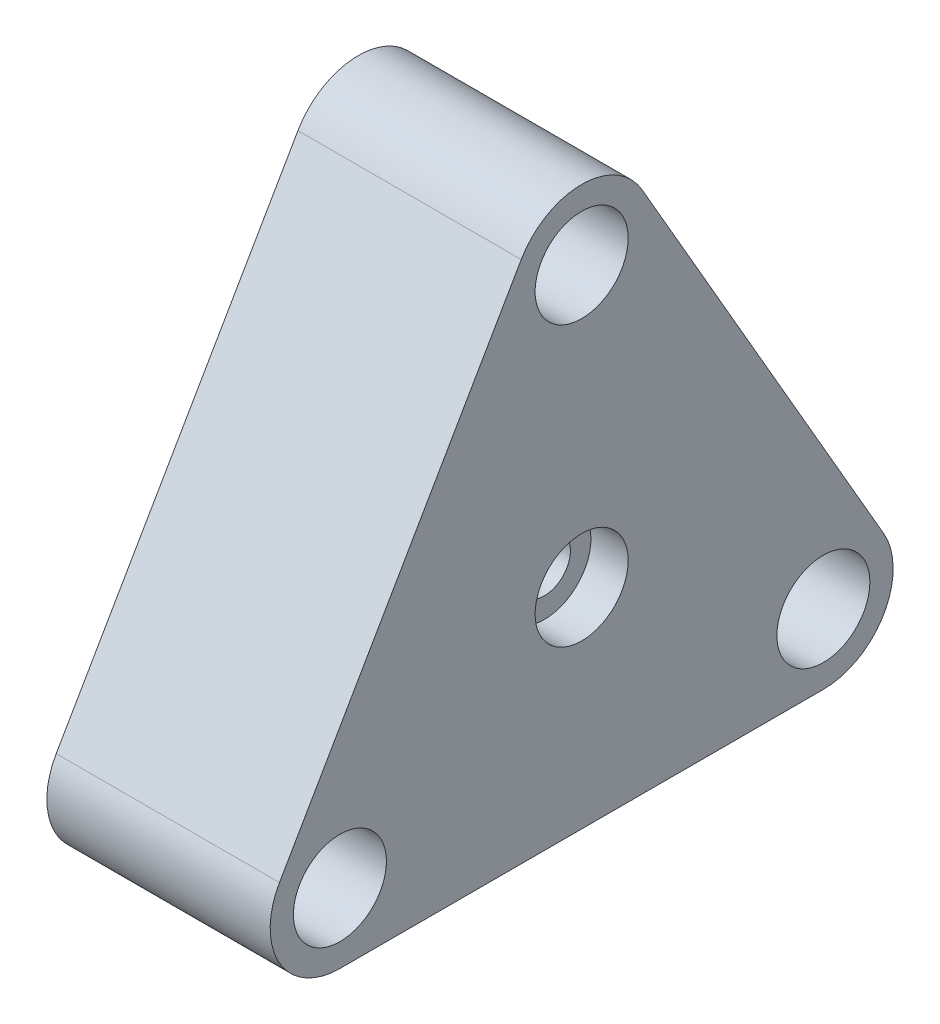
from build123d import *

# Parameters (mm, degrees)
BOSS_EXTRUDE1_DEPTH       = 6
SKETCH4_R                 = 2.5
CUT_EXTRUDE1_DEPTH        = 6
SKETCH5_R                 = 2.5
CUT_EXTRUDE2_DEPTH        = 6
F_3_CLEARANCE_HOLE1_D     = 2.794
F_3_CLEARANCE_HOLE1_DEPTH = 6
F_3_CLEARANCE_HOLE1_TIP   = 0.839402285
F_3_CLEARANCE_HOLE2_D     = 2.794
F_3_CLEARANCE_HOLE2_DEPTH = 6
F_3_CLEARANCE_HOLE2_TIP   = 0.839402285
CUT_EXTRUDE3_START        = -2
SKETCH11_R                = 2.5
CUT_EXTRUDE3_DEPTH        = 2
CUT_EXTRUDE4_START        = -2
SKETCH12_R                = 2.5
CUT_EXTRUDE4_DEPTH        = 2


with BuildPart() as part:
    # Sketch3 → Boss-Extrude1 (new, symmetric)
    with BuildSketch(Plane(origin=(0, 0, 0), x_dir=(0, 0, -1), z_dir=(1, 0, 0))):
        with BuildLine():
            Line((-16.237976321, -5.625), (-3.247595264, 16.875))
            ThreePointArc((-3.247595264, 16.875), (0, 18.75), (3.247595264, 16.875))
            Line((3.247595264, 16.875), (16.237976321, -5.625))
            ThreePointArc((16.237976321, -5.625), (16.237976321, -9.375), (12.990381057, -11.25))
            Line((12.990381057, -11.25), (-12.990381057, -11.25))
            ThreePointArc((-12.990381057, -11.25), (-16.237976321, -9.375), (-16.237976321, -5.625))
        make_face()
    extrude(amount=BOSS_EXTRUDE1_DEPTH, both=True)

    # Sketch4 → Cut-Extrude1 (cut)
    with BuildSketch(Plane(origin=(6, 0, 0), x_dir=(0, 0, -1), z_dir=(1, 0, 0))):
        with Locations((0, 15)):
            Circle(SKETCH4_R)
        with Locations((-12.990381057, -7.5)):
            Circle(SKETCH4_R)
        with Locations((12.990381057, -7.5)):
            Circle(SKETCH4_R)
    extrude(amount=-CUT_EXTRUDE1_DEPTH, mode=Mode.SUBTRACT)

    # Sketch5 → Cut-Extrude2 (cut)
    with BuildSketch(Plane.ZY.offset(6)):
        Circle(SKETCH5_R)
    extrude(amount=-CUT_EXTRUDE2_DEPTH, mode=Mode.SUBTRACT)

    # #3 Clearance Hole1
    with Locations(Plane(origin=(0, 0, 0), x_dir=(0, 0, -1), z_dir=(1, 0, 0))):
        with Locations((12.990381057, -7.5), (0, 15), (-12.990381057, -7.5)):
            Hole(F_3_CLEARANCE_HOLE1_D / 2, depth=F_3_CLEARANCE_HOLE1_DEPTH)
            with Locations((0, 0, -(F_3_CLEARANCE_HOLE1_DEPTH + F_3_CLEARANCE_HOLE1_TIP / 2))):  # 118° drill point
                Cone(0, F_3_CLEARANCE_HOLE1_D / 2, F_3_CLEARANCE_HOLE1_TIP, mode=Mode.SUBTRACT)

    # #3 Clearance Hole2
    with Locations(Plane.ZY):
        with Locations((0, 0)):
            Hole(F_3_CLEARANCE_HOLE2_D / 2, depth=F_3_CLEARANCE_HOLE2_DEPTH)
            with Locations((0, 0, -(F_3_CLEARANCE_HOLE2_DEPTH + F_3_CLEARANCE_HOLE2_TIP / 2))):  # 118° drill point
                Cone(0, F_3_CLEARANCE_HOLE2_D / 2, F_3_CLEARANCE_HOLE2_TIP, mode=Mode.SUBTRACT)

    # Sketch11 → Cut-Extrude3 (cut)
    with BuildSketch(Plane.ZY.offset(6).offset(CUT_EXTRUDE3_START)):
        with Locations(Location((0, 15, 0), (0, 0, 180))):
            Circle(SKETCH11_R)
        with Locations(Location((-12.990381057, -7.5, 0), (0, 0, 180))):
            Circle(SKETCH11_R)
        with Locations(Location((12.990381057, -7.5, 0), (0, 0, 180))):
            Circle(SKETCH11_R)
    extrude(amount=CUT_EXTRUDE3_DEPTH, mode=Mode.SUBTRACT)

    # Sketch12 → Cut-Extrude4 (cut)
    with BuildSketch(Plane(origin=(6, 0, 0), x_dir=(0, 0, -1), z_dir=(1, 0, 0)).offset(CUT_EXTRUDE4_START)):
        with Locations(Location((0, 0, 0), (0, 0, 180))):
            Circle(SKETCH12_R)
    extrude(amount=CUT_EXTRUDE4_DEPTH, mode=Mode.SUBTRACT)


solid = part.part
